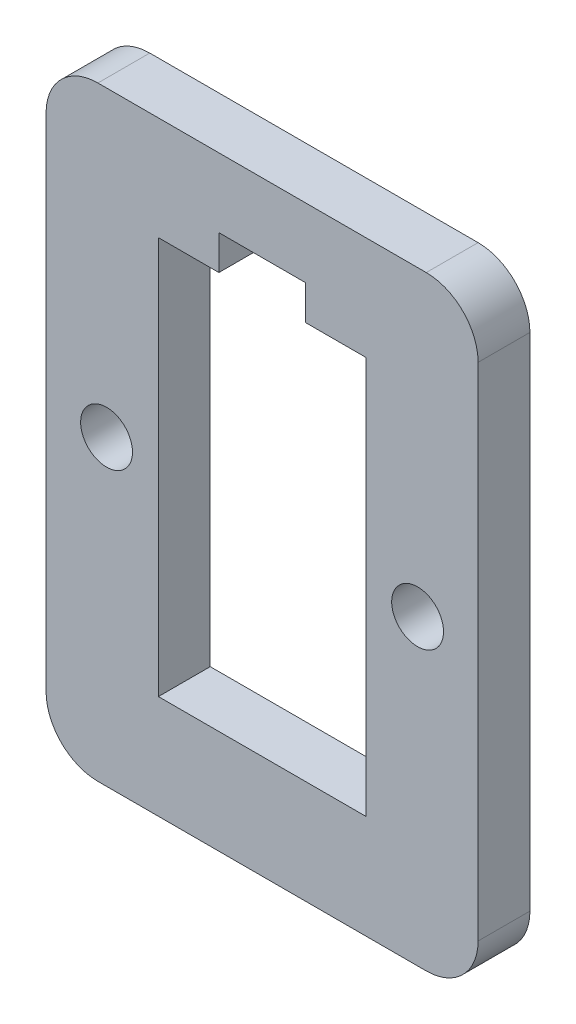
from build123d import *

# Parameters (mm, degrees)
SKETCH_1_R      = 1.500000002
EXTRUDE_1_DEPTH = 3


with BuildPart() as part:
    # 草圖1 → 填料-伸長1 (new body)
    with BuildSketch(Plane.XY):
        with BuildLine():
            Line((155.0002, 71), (174.0002, 71))
            ThreePointArc((174.0002, 71), (176.121520344, 71.878679656), (177.0002, 74))
            Line((177.0002, 74), (177.0002, 103))
            ThreePointArc((177.0002, 103), (176.121520344, 105.121320344), (174.0002, 106))
            Line((174.0002, 106), (155.0002, 106))
            ThreePointArc((155.0002, 106), (152.878879656, 105.121320344), (152.0002, 103))
            Line((152.0002, 103), (152.0002, 74))
            ThreePointArc((152.0002, 74), (152.878879656, 71.878679656), (155.0002, 71))
        make_face()
        with Locations((155.500199998, 88.499999998)):
            Circle(SKETCH_1_R, mode=Mode.SUBTRACT)
        with Locations((173.500199998, 88.499999998)):
            Circle(SKETCH_1_R, mode=Mode.SUBTRACT)
        Polygon((170.5002, 77), (170.5002, 100), (167.0002, 100), (167.0002, 102.0001), (162.0002, 102.0001), (162.0002, 100), (158.5002, 100), (158.5002, 77), align=None, mode=Mode.SUBTRACT)
    extrude(amount=EXTRUDE_1_DEPTH)


solid = part.part
